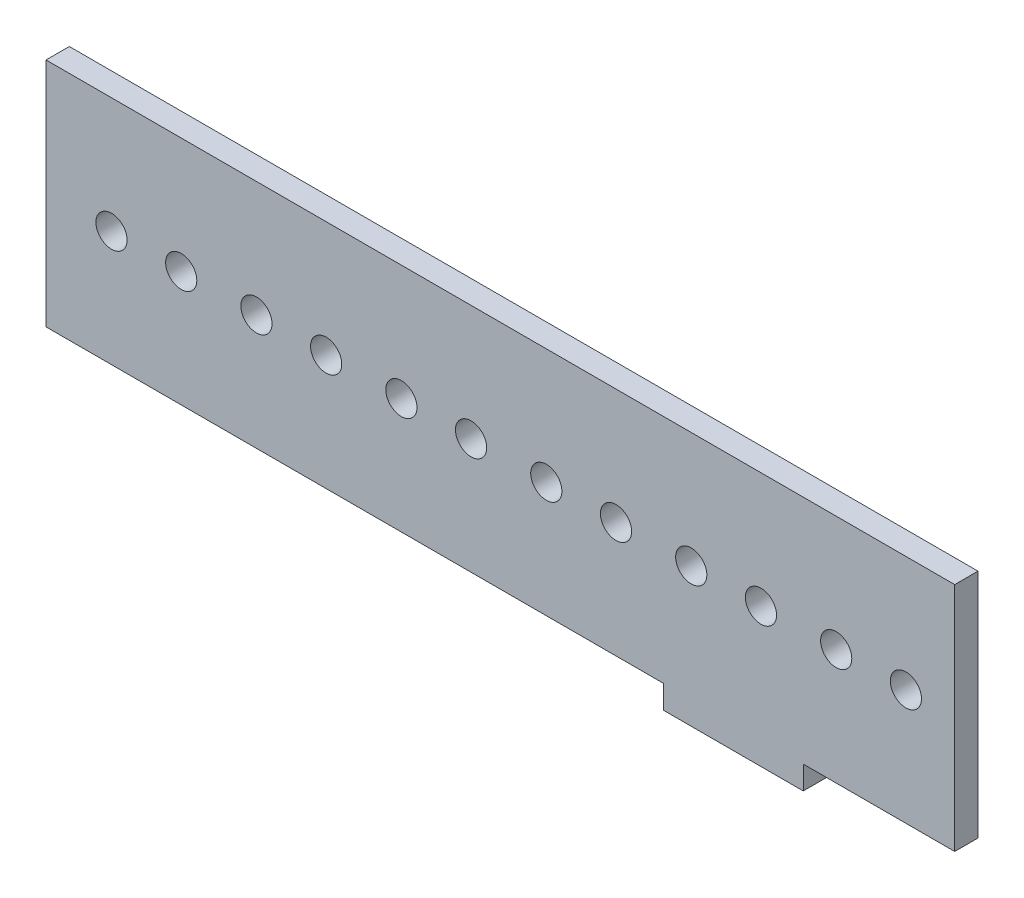
from build123d import *

# Parameters (mm, degrees)
SKETCH3_R           = 4.25
BOSS_EXTRUDE1_DEPTH = 6.35


with BuildPart() as part:
    # Sketch3 → Boss-Extrude1 (new body)
    with BuildSketch(Plane.XY):
        Polygon((123.825, 31.5), (123.825, -31.5), (82.55, -31.5), (82.55, -37.85), (44.45, -37.85), (44.45, -31.5), (-123.825, -31.5), (-123.825, 31.5), align=None)
        with Locations((-105.975, 0)):
            Circle(SKETCH3_R, mode=Mode.SUBTRACT)
        with Locations((-86.975, 0)):
            Circle(SKETCH3_R, mode=Mode.SUBTRACT)
        with Locations((-66.475, 0)):
            Circle(SKETCH3_R, mode=Mode.SUBTRACT)
        with Locations((-47.475, 0)):
            Circle(SKETCH3_R, mode=Mode.SUBTRACT)
        with Locations((-26.975, 0)):
            Circle(SKETCH3_R, mode=Mode.SUBTRACT)
        with Locations((-7.975, 0)):
            Circle(SKETCH3_R, mode=Mode.SUBTRACT)
        with Locations((12.525, 0)):
            Circle(SKETCH3_R, mode=Mode.SUBTRACT)
        with Locations((31.525, 0)):
            Circle(SKETCH3_R, mode=Mode.SUBTRACT)
        with Locations((52.025, 0)):
            Circle(SKETCH3_R, mode=Mode.SUBTRACT)
        with Locations((71.025, 0)):
            Circle(SKETCH3_R, mode=Mode.SUBTRACT)
        with Locations((91.525, 0)):
            Circle(SKETCH3_R, mode=Mode.SUBTRACT)
        with Locations((110.525, 0)):
            Circle(SKETCH3_R, mode=Mode.SUBTRACT)
    extrude(amount=BOSS_EXTRUDE1_DEPTH)


solid = part.part
